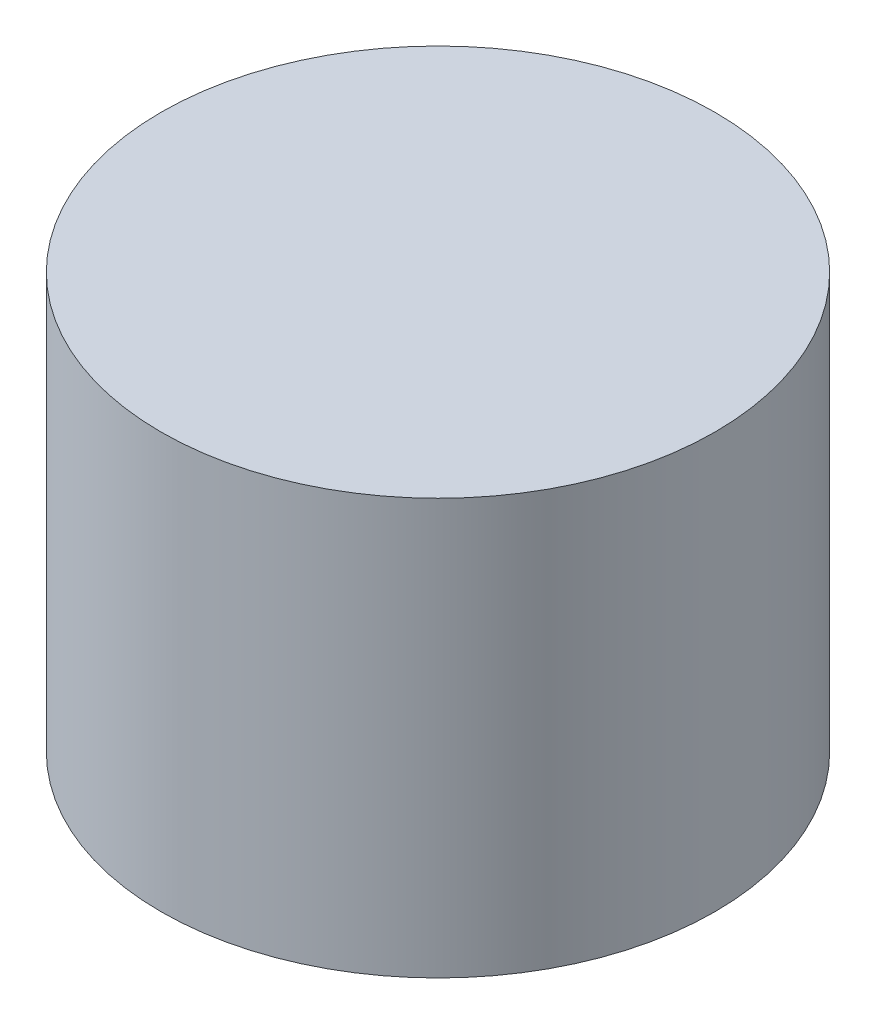
from build123d import *

# Parameters (mm, degrees)
OVEN_EGZOZ_FANI_D120_START = 1700
SKETCH1_R                  = 60
OVEN_EGZOZ_FANI_D120_DEPTH = 90


with BuildPart() as part:
    # Sketch1 → OVEN_egzoz_fani_D120 (new body)
    with BuildSketch(Plane(origin=(0, 0, 0), x_dir=(1, 0, 0), z_dir=(0, 1, 0)).offset(OVEN_EGZOZ_FANI_D120_START)):
        with Locations(Location((500, 300, 0), (0, 0, 90))):
            Circle(SKETCH1_R)
    extrude(amount=OVEN_EGZOZ_FANI_D120_DEPTH)


solid = part.part
